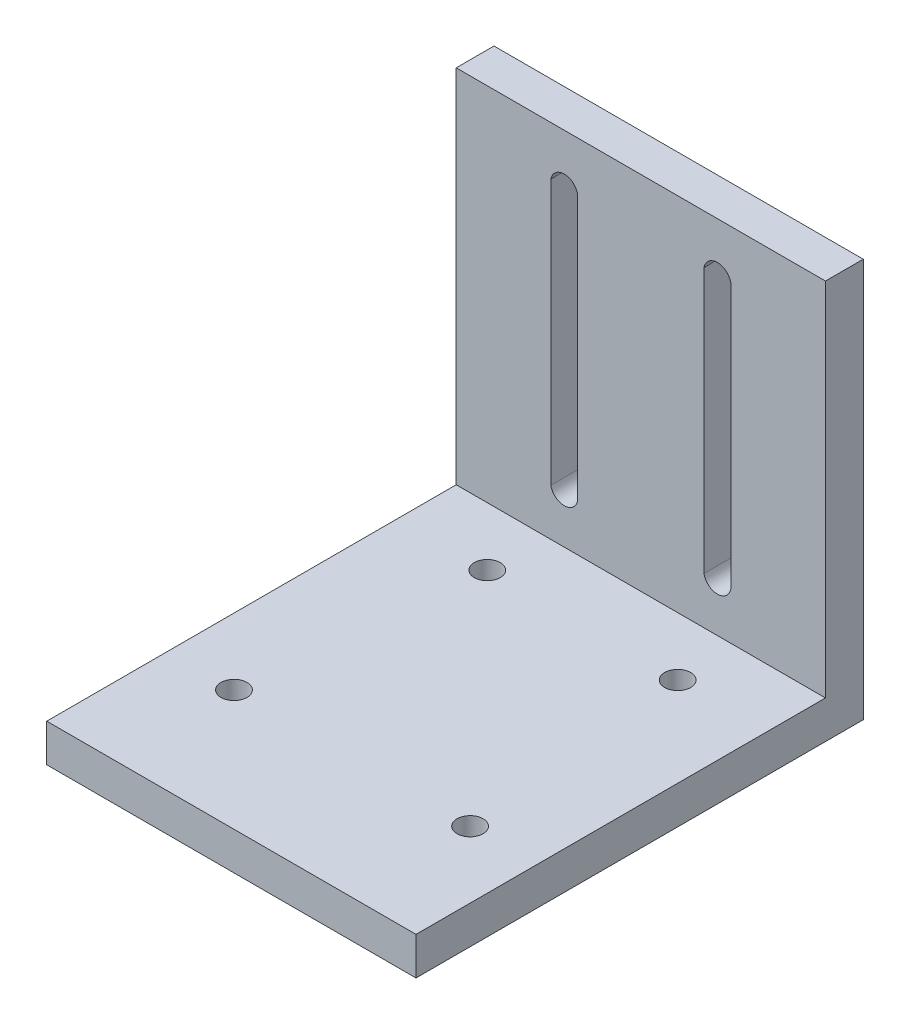
from build123d import *

# Parameters (mm, degrees)
SKETCH1_W                = 68.072
SKETCH1_H                = 76.327
BOSS_EXTRUDE1_DEPTH      = 63.0174
SKETCH2_W                = 69.8754
SKETCH2_H                = 61.6204
CUT_EXTRUDE1_DEPTH       = 113.452363516
CUT_EXTRUDE2_DEPTH       = 101.05830175
CUT_EXTRUDE3_DEPTH       = 105.665673231
M4_CLEARANCE_HOLE1_D     = 4.445
M4_CLEARANCE_HOLE1_DEPTH = 68.072


with BuildPart() as part:
    # Sketch1 → Boss-Extrude1 (new body)
    with BuildSketch(Plane(origin=(-15.262172061, 0, 0), x_dir=(0, -1, 0), z_dir=(-1, 0, 0))):
        with Locations((19.335625687, 38.1635)):
            Rectangle(SKETCH1_W, SKETCH1_H)
    extrude(amount=-BOSS_EXTRUDE1_DEPTH)

    # Sketch2 → Cut-Extrude1 (cut, through all)
    with BuildSketch(Plane(origin=(47.755227939, 0, 0), x_dir=(0, 0, -1), z_dir=(1, 0, 0))):
        with Locations((-41.3893, -16.109825687)):
            Rectangle(SKETCH2_W, SKETCH2_H)
    extrude(amount=-CUT_EXTRUDE1_DEPTH, mode=Mode.SUBTRACT)

    # Sketch3 → Cut-Extrude2 (cut, through all)
    with BuildSketch(Plane.XY.offset(6.4516)):
        with BuildLine():
            Line((5.464227939, -38.893127295), (5.464227939, 6.317876942))
            ThreePointArc((5.464227939, 6.317876942), (3.187772185, 8.223345793), (0.892227939, 6.340916789))
            Line((0.892227939, 6.340916789), (0.892227939, -38.916167142))
            ThreePointArc((0.892227939, -38.916167142), (3.187772185, -40.798596146), (5.464227939, -38.893127295))
        make_face()
    extrude(amount=-CUT_EXTRUDE2_DEPTH, mode=Mode.SUBTRACT)

    # Sketch4 → Cut-Extrude3 (cut, through all)
    with BuildSketch(Plane(origin=(0, 0, 0), x_dir=(-1, 0, 0), z_dir=(0, 0, -1))):
        with BuildLine():
            Line((-27.028827939, -38.893127295), (-27.028827939, 6.317876942))
            ThreePointArc((-27.028827939, 6.317876942), (-29.305283692, 8.223345793), (-31.600827939, 6.340916789))
            Line((-31.600827939, 6.340916789), (-31.600827939, -38.916167142))
            ThreePointArc((-31.600827939, -38.916167142), (-29.305283692, -40.798596146), (-27.028827939, -38.893127295))
        make_face()
    extrude(amount=-CUT_EXTRUDE3_DEPTH, mode=Mode.SUBTRACT)

    # M4 Clearance Hole1
    with Locations(Plane.XZ.offset(53.371625687)):
        with Locations((32.493055877, 16.408909131), (0, 16.408909131), (36.391998544, 55.735080284), (-3.898942667, 55.735080284)):
            Hole(M4_CLEARANCE_HOLE1_D / 2, depth=M4_CLEARANCE_HOLE1_DEPTH)


solid = part.part
